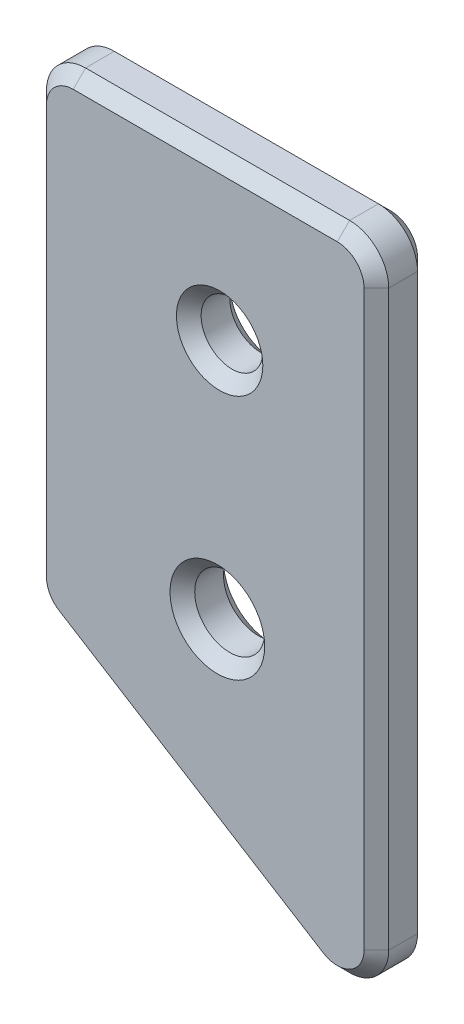
from build123d import *

# Parameters (mm, degrees)
SKETCH1_R           = 4.25
SKETCH1_R_2         = 3.75
SKETCH1_R_3         = 4.5
BOSS_EXTRUDE1_DEPTH = 6.5
CUT_EXTRUDE1_DEPTH  = 10
FILLET1_R           = 4.75
CHAMFER1_SIZE       = 1.5


with BuildPart() as part:
    # Sketch1 → Boss-Extrude1 (new body)
    with BuildSketch(Plane.XY):
        with BuildLine():
            Line((-11.458079381, -19.05), (53.381074139, -59.408818568))
            ThreePointArc((53.381074139, -59.408818568), (58.197626483, -59.528635467), (60.641156228, -55.376203052))
            Line((60.641156228, -55.376203052), (60.641156228, 14.3))
            ThreePointArc((60.641156228, 14.3), (59.249913439, 17.658757211), (55.891156228, 19.05))
            Line((55.891156228, 19.05), (-13.723477062, 19.05))
            ThreePointArc((-13.723477062, 19.05), (-14.628464695, 18.040083046), (-15.73121772, 18.829304583))
            ThreePointArc((-15.73121772, 18.829304583), (-17.658815789, 17.658815789), (-18.829304583, 15.73121772))
            ThreePointArc((-18.829304583, 15.73121772), (-18.040083046, 14.628464695), (-19.05, 13.723477062))
            Line((-19.05, 13.723477062), (-19.05, 8.996305235))
            ThreePointArc((-19.05, 8.996305235), (-18.034, 7.980305235), (-19.05, 6.964305235))
            Line((-19.05, 6.964305235), (-19.05, -6.964305235))
            ThreePointArc((-19.05, -6.964305235), (-18.034, -7.980305235), (-19.05, -8.996305235))
            Line((-19.05, -8.996305235), (-19.05, -13.723477062))
            ThreePointArc((-19.05, -13.723477062), (-18.040083046, -14.628464695), (-18.829304583, -15.73121772))
            ThreePointArc((-18.829304583, -15.73121772), (-17.658815789, -17.658815789), (-15.73121772, -18.829304583))
            ThreePointArc((-15.73121772, -18.829304583), (-14.628464695, -18.040083046), (-13.723477062, -19.05))
            Line((-13.723477062, -19.05), (-11.458079381, -19.05))
        make_face()
        with Locations(Location((41.314990606, -29.4594322, 0), (0, 0, 180))):
            Circle(SKETCH1_R, mode=Mode.SUBTRACT)
        with Locations(Location((41.591156228, 0, 0), (0, 0, 180))):
            Circle(SKETCH1_R_2, mode=Mode.SUBTRACT)
        with Locations(Location((0, 0, 0), (0, 0, 180))):
            Circle(SKETCH1_R_3, mode=Mode.SUBTRACT)
    extrude(amount=BOSS_EXTRUDE1_DEPTH)

    # Sketch3 → Cut-Extrude1 (cut)
    with BuildSketch(Plane(origin=(0, 0, 0), x_dir=(-1, 0, 0), z_dir=(0, 0, -1))):
        with BuildLine():
            Line((19.05, 6.964305235), (19.05, -6.964305235))
            Line((19.05, -6.964305235), (19.05, -13.723477062))
            Line((19.05, -13.723477062), (18.829304583, -15.73121772))
            ThreePointArc((18.829304583, -15.73121772), (17.658815789, -17.658815789), (15.73121772, -18.829304583))
            Line((15.73121772, -18.829304583), (13.723477062, -19.05))
            Line((13.723477062, -19.05), (11.458079381, -19.05))
            Line((11.458079381, -19.05), (-19.05, -38.039606954))
            Line((-19.05, -38.039606954), (-19.05, 8.996305235))
            Line((-19.05, 8.996305235), (-19.05, 13.723477062))
            Line((-19.05, 13.723477062), (-19.05, 19.05))
            Line((-19.05, 19.05), (13.723477062, 19.05))
            Line((13.723477062, 19.05), (15.73121772, 18.829304583))
            ThreePointArc((15.73121772, 18.829304583), (17.658815789, 17.658815789), (18.829304583, 15.73121772))
            Line((18.829304583, 15.73121772), (19.05, 13.723477062))
            Line((19.05, 13.723477062), (19.05, 6.964305235))
        make_face()
    extrude(amount=-CUT_EXTRUDE1_DEPTH, mode=Mode.SUBTRACT)

    # Fillet1
    fillet1_edges = [part.edges().sort_by_distance(p)[0] for p in [
        (19.05, -38.039606954, 3.25),
        (19.05, 19.05, 3.25),
    ]]
    fillet(fillet1_edges, radius=FILLET1_R)

    # Chamfer1
    chamfer1_edges = [part.edges().sort_by_distance(p)[0] for p in [
        (45.341156228, 0, 6.5),
        (45.564990606, -29.4594322, 6.5),
        (19.05, -10.550608772, 0),
        (20.441242789, 17.658757211, 0),
        (19.647567585, -37.707687799, 0),
        (19.05, -10.550608772, 6.5),
        (20.441242789, 17.658757211, 6.5),
        (19.647567585, -37.707687799, 6.5),
        (37.335496024, -49.421325814, 6.5),
        (45.564990606, -29.4594322, 0),
        (45.341156228, 0, 0),
        (58.197626483, -59.528635467, 6.5),
        (60.641156228, -20.538101526, 6.5),
        (39.845578114, 19.05, 0),
        (59.249913439, 17.658757211, 0),
        (60.641156228, -20.538101526, 0),
        (58.197626483, -59.528635467, 0),
        (37.335496024, -49.421325814, 0),
        (59.249913439, 17.658757211, 6.5),
        (39.845578114, 19.05, 6.5),
    ]]
    chamfer(chamfer1_edges, length=CHAMFER1_SIZE)


solid = part.part
